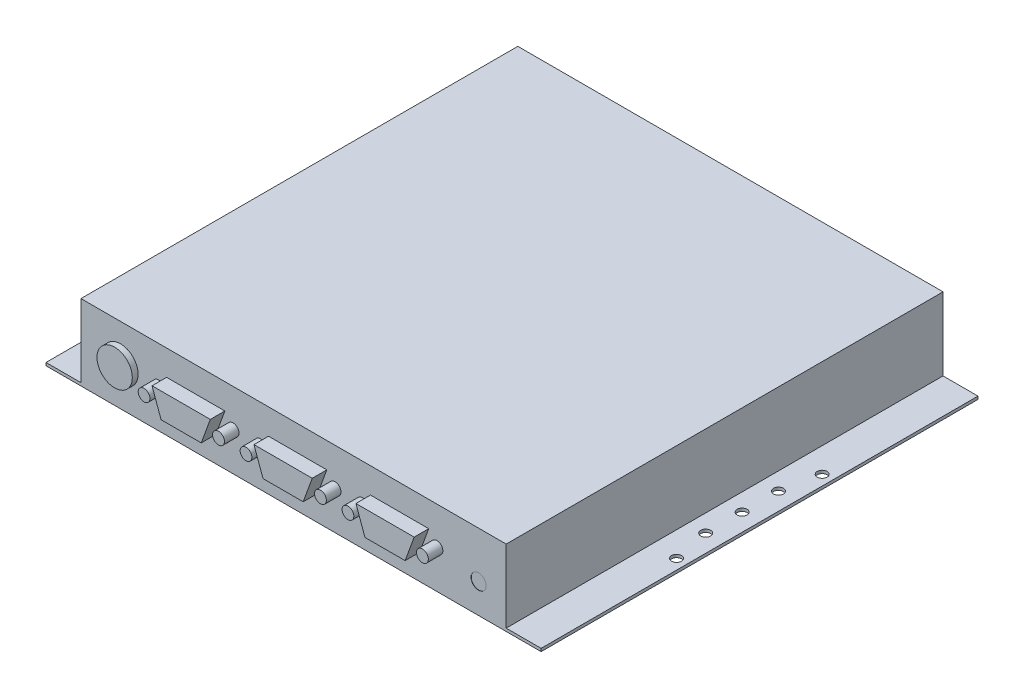
from build123d import *

# Parameters (mm, degrees)
SKETCH_1_W             = 146
SKETCH_1_H             = 150
EXTRUDE_1_DEPTH        = 26
SKETCH_2_W             = 170
SKETCH_2_H             = 150
EXTRUDE_2_DEPTH        = 1
HOLE_WIZARD_M3_1_D     = 3.4
SKETCH_5_R             = 6.063811431
EXTRUDE_3_DEPTH        = 2
SKETCH_6_R             = 2.017692423
SKETCH_6_R_2           = 2.03992662
EXTRUDE_4_DEPTH        = 5
PATTERN_LINEAR_1_COUNT = 3
PATTERN_LINEAR_1_PITCH = 35
SKETCH_7_R             = 2.600130351
CUT_EXTRUDE_1_DEPTH    = 0.1
SKETCH_8_W             = 14.672164123
SKETCH_8_H             = 4.828813509
SKETCH_8_W_2           = 14.114993332
SKETCH_8_H_2           = 5.014537105
SKETCH_8_W_3           = 16.157952894
SKETCH_8_H_3           = 14.114993333
CUT_EXTRUDE_2_DEPTH    = 0.1
SKETCH_9_R             = 1.296267094
SKETCH_9_W             = 20.070729893
SKETCH_9_H             = 2.548664114
EXTRUDE_5_DEPTH        = 0.1


with BuildPart() as part:
    # 草图1 → 凸台-拉伸1 (new body)
    with BuildSketch(Plane(origin=(0, 0, 0), x_dir=(1, 0, 0), z_dir=(0, 1, 0))):
        Rectangle(SKETCH_1_W, SKETCH_1_H)
    extrude(amount=EXTRUDE_1_DEPTH)

    # 草图2 → 凸台-拉伸2 (add)
    with BuildSketch(Plane.XZ):
        Rectangle(SKETCH_2_W, SKETCH_2_H)
    extrude(amount=-EXTRUDE_2_DEPTH)

    # M3 间隙孔1 (through all)
    with Locations(Plane(origin=(0, 1, 0), x_dir=(1, 0, 0), z_dir=(0, 1, 0))):
        with Locations((-81.5, 25), (-81.5, -25), (81.5, 25), (81.5, -25), (-79, 12.5), (-79, 0), (-79, -12.5), (79, -12.5), (79, 0), (79, 12.5)):
            Hole(HOLE_WIZARD_M3_1_D / 2)

    # 草图5 → 凸台-拉伸3 (add)
    with BuildSketch(Plane.XY.offset(75)):
        with Locations(Location((-59.431550874, 13.278585395, 0), (0, 0, 180))):
            Circle(SKETCH_5_R)
    extrude(amount=EXTRUDE_3_DEPTH)

    # 草图6 → 凸台-拉伸4 (add)
    with BuildSketch(Plane.XY.offset(75)):
        with Locations(Location((-46.32884835, 13.11494848, 0), (0, 0, 180))):
            Circle(SKETCH_6_R)
        with Locations(Location((-20.769548413, 13.11494848, 0), (0, 0, 180))):
            Circle(SKETCH_6_R_2)
        Polygon((-43.590070032, 17.274031542), (-23.590070032, 17.274031542), (-26.696119877, 8.72468841), (-40.484020187, 8.72468841), align=None)
    extrude_4 = extrude(amount=EXTRUDE_4_DEPTH)

    # 阵列(线性)1: 凸台-拉伸4 ×3
    with Locations(*[(i * PATTERN_LINEAR_1_PITCH, 0, 0) for i in range(1, PATTERN_LINEAR_1_COUNT)]):
        add(extrude_4)

    # 草图7 → 切除-拉伸1 (cut)
    with BuildSketch(Plane.XY.offset(75)):
        with Locations((63.517469997, 10.121284255)):
            Circle(SKETCH_7_R)
    extrude(amount=-CUT_EXTRUDE_1_DEPTH, mode=Mode.SUBTRACT)

    # 草图8 → 切除-拉伸2 (cut)
    with BuildSketch(Plane(origin=(0, 0, -75), x_dir=(-1, 0, 0), z_dir=(0, 0, -1))):
        Polygon((2.600130351, 20.521805658), (-4.085919123, 17.995663664), (-4.085919123, 7.154283691), (2.600130351, 4.921023553), align=None)
        with Locations((18.293774254, 18.107398904)):
            Rectangle(SKETCH_8_W, SKETCH_8_H)
        with Locations((36.9589957, 18.107398904)):
            Rectangle(SKETCH_8_W_2, SKETCH_8_H)
        with Locations((18.293774254, 8.914080878)):
            Rectangle(SKETCH_8_W, SKETCH_8_H_2)
        with Locations((36.9589957, 8.914080878)):
            Rectangle(SKETCH_8_W_2, SKETCH_8_H_2)
        with Locations((58.967241883, 13.464308992)):
            Rectangle(SKETCH_8_W_3, SKETCH_8_H_3)
    extrude(amount=-CUT_EXTRUDE_2_DEPTH, mode=Mode.SUBTRACT)

    # 草图9 → 凸台-拉伸5 (add)
    with BuildSketch(Plane(origin=(0, 0, -75), x_dir=(-1, 0, 0), z_dir=(0, 0, -1))):
        with Locations(Location((-64.611587391, 7.936618922, 0), (0, 0, 180))):
            Circle(SKETCH_9_R)
        with Locations((-45.443509371, 8.149007598)):
            Rectangle(SKETCH_9_W, SKETCH_9_H)
    extrude(amount=EXTRUDE_5_DEPTH)


solid = part.part
